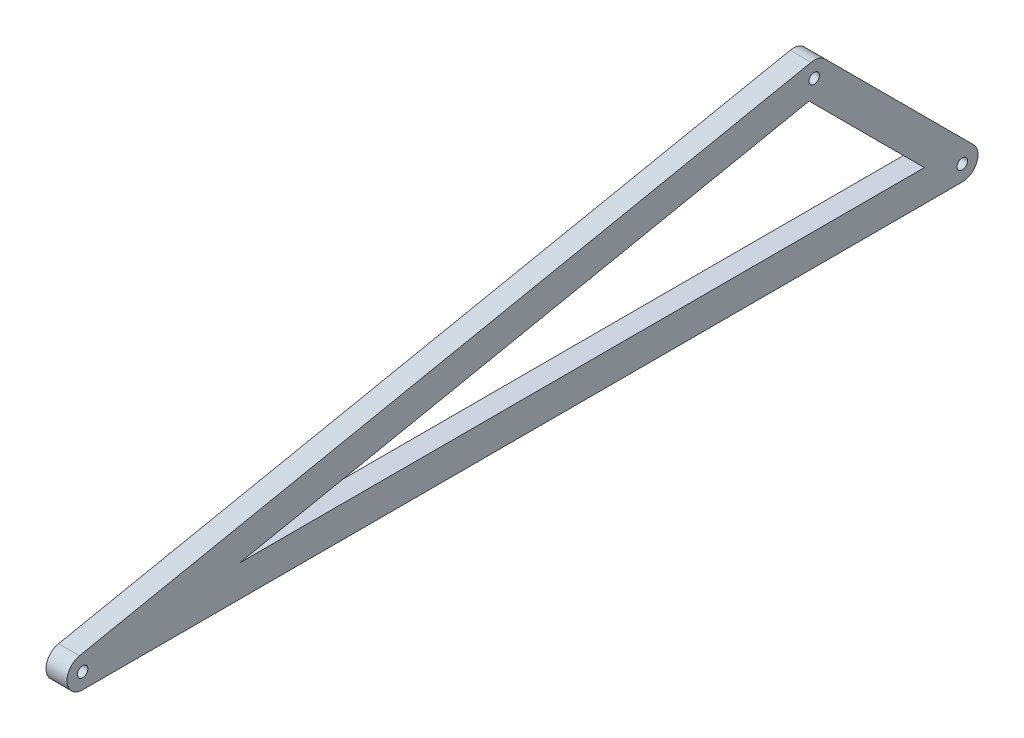
from build123d import *

# Parameters (mm, degrees)
SKETCH_1_R      = 0.5
EXTRUDE_1_DEPTH = 2
SKETCH_2_R      = 0.5
EXTRUDE_2_DEPTH = 2


with BuildPart() as part:
    # 草图1 → 凸台-拉伸1 (new body)
    with BuildSketch(Plane(origin=(0, 0, 0), x_dir=(0, 0, -1), z_dir=(1, 0, 0))):
        with BuildLine():
            Line((-8.746696486, 4.522861275), (75.253303514, 4.522861275))
            ThreePointArc((75.253303514, 4.522861275), (76.753303514, 3.022861275), (75.253303514, 1.522861275))
            Line((75.253303514, 1.522861275), (-8.746696486, 1.522861275))
            ThreePointArc((-8.746696486, 1.522861275), (-10.246696486, 3.022861275), (-8.746696486, 4.522861275))
        make_face()
        with Locations((-8.746696486, 3.022861275)):
            Circle(SKETCH_1_R, mode=Mode.SUBTRACT)
        with Locations((75.253303514, 3.022861275)):
            Circle(SKETCH_1_R, mode=Mode.SUBTRACT)
    extrude(amount=EXTRUDE_1_DEPTH)

    # 草图2 → 凸台-拉伸2 (add)
    with BuildSketch(Plane.ZY):
        with BuildLine():
            Line((-62.171828062, 18.22565707), (-76.313963686, 4.083521447))
            ThreePointArc((-76.313963686, 4.083521447), (-76.313963686, 1.962201103), (-74.192643342, 1.962201103))
            Line((-74.192643342, 1.962201103), (-60.619757708, 15.535086737))
            Line((-60.619757708, 15.535086737), (8.449071616, 1.552684606))
            ThreePointArc((8.449071616, 1.552684606), (10.216873155, 2.725236404), (9.044321357, 4.493037943))
            Line((9.044321357, 4.493037943), (-60.81354302, 18.635173567))
            ThreePointArc((-60.81354302, 18.635173567), (-61.544159412, 18.601143946), (-62.171828062, 18.22565707))
        make_face()
        with Locations((-61.11116789, 17.164996899)):
            Circle(SKETCH_2_R, mode=Mode.SUBTRACT)
        with Locations(Location((-75.253303514, 3.022861275, 0), (0, 0, 180))):
            Circle(SKETCH_2_R, mode=Mode.SUBTRACT)
        with Locations(Location((8.746696486, 3.022861275, 0), (0, 0, 180))):
            Circle(SKETCH_2_R, mode=Mode.SUBTRACT)
    extrude(amount=-EXTRUDE_2_DEPTH)


solid = part.part
